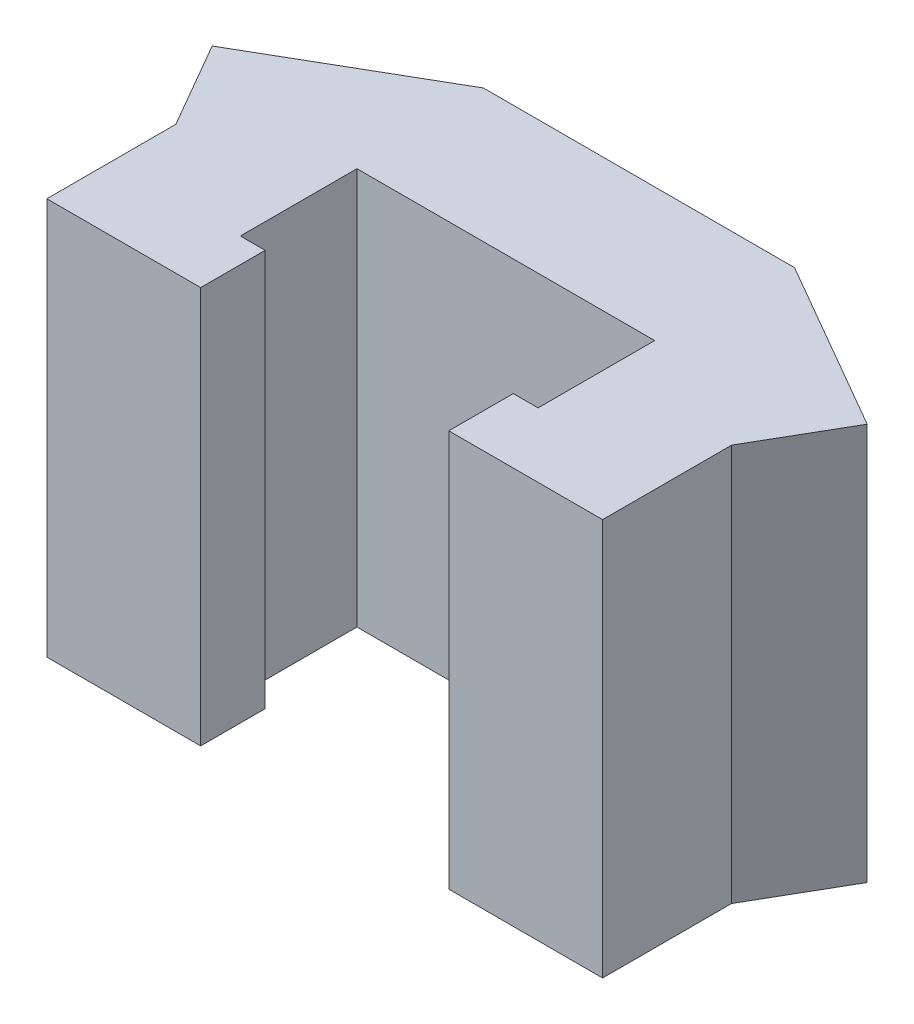
from build123d import *

# Parameters (mm, degrees)
EXTRUDE_1_DEPTH = 40


with BuildPart() as part:
    # 草圖2 → 填料-伸長1 (new body)
    with BuildSketch(Plane(origin=(0, 0, 0), x_dir=(1, 0, 0), z_dir=(0, 1, 0))):
        Polygon((-15.029337856, -9.221199976), (-12.529337856, -9.221199976), (-12.529337856, -15.721199976), (-28.029337856, -15.721199976), (-28.029337856, -2.721199976), (-33.029337856, 5.939054062), (-15.70882978, 15.939054062), (15.650154068, 15.939054062), (32.970662144, 5.939054062), (27.970662144, -2.721199976), (27.970662144, -15.721199976), (12.470662144, -15.721199976), (12.470662144, -9.221199976), (14.970662144, -9.221199976), (14.970662144, 2.528800024), (-15.029337856, 2.528800024), align=None)
    extrude(amount=EXTRUDE_1_DEPTH)


solid = part.part
